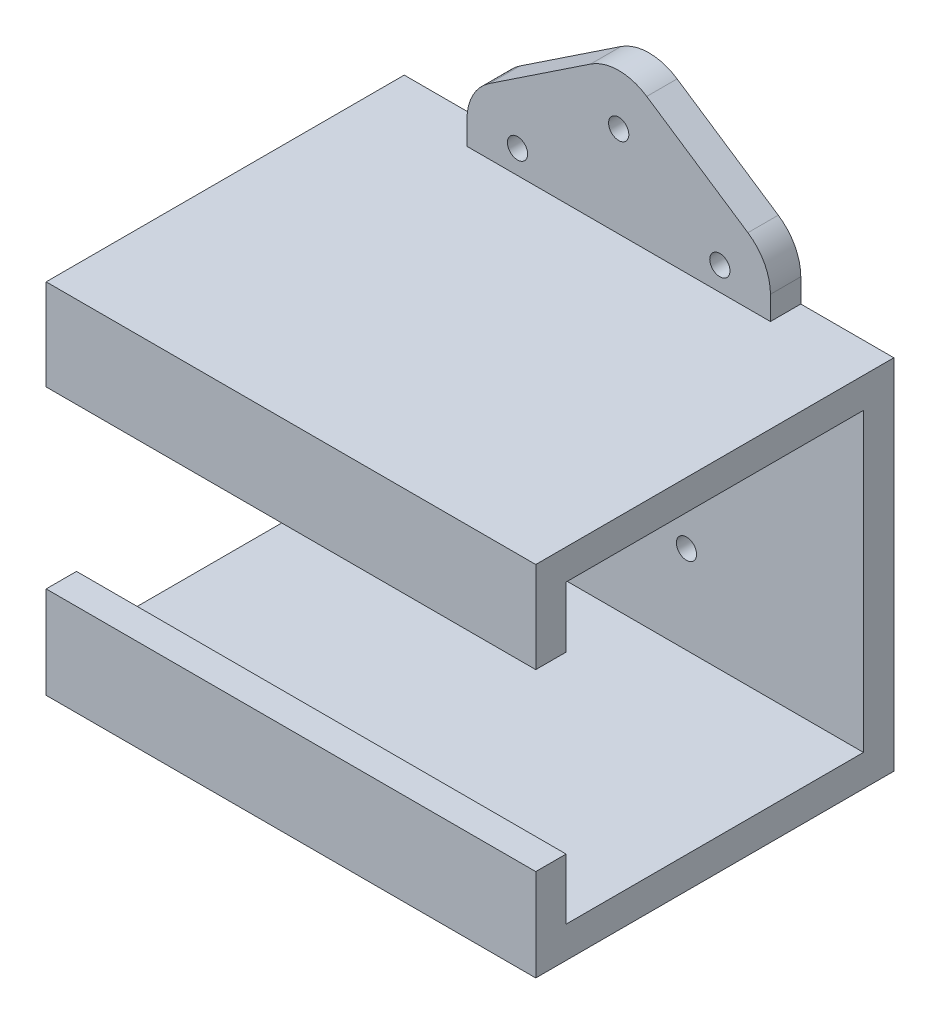
from build123d import *

# Parameters (mm, degrees)
SKETCH4_W                = 48.4
SKETCH4_H                = 35.4
BOTTOM_PLATE_DEPTH       = 3
SKETCH5_W                = 48.4
SKETCH5_H                = 3
SKETCH5_H_2              = 3.111627182
SIDE_PLATE_DEPTH         = 32.4
SKETCH6_W                = 48.4
SKETCH6_H                = 3
TOP_PLATE_1_DEPTH        = 6
SKETCH7_W                = 48.4
SKETCH7_H                = 3
TOP_PLATE_2_DEPTH        = 6
CAMERA_SCREW_HOLES_REACH = 64.688
SKETCH8_R                = 1
SKETCH10_R               = 1
CASE_ATTACHMENT_1_DEPTH  = 3
SKETCH10_4_R             = 1
CASE_ATTACHMENT_2_DEPTH  = 3


with BuildPart() as part:
    # Sketch4 → Bottom_Plate (new body)
    with BuildSketch(Plane.XY):
        with Locations((-19.226323529, -13.831389527)):
            Rectangle(SKETCH4_W, SKETCH4_H)
    extrude(amount=BOTTOM_PLATE_DEPTH)

    # Sketch5 → Side_Plate (add)
    with BuildSketch(Plane.XY.offset(3)):
        with Locations((-19.226323529, 2.368610473)):
            Rectangle(SKETCH5_W, SKETCH5_H)
        with Locations((-19.226323529, -29.975575936)):
            Rectangle(SKETCH5_W, SKETCH5_H_2)
    extrude(amount=SIDE_PLATE_DEPTH)

    # Sketch6 → Top_Plate_1 (add)
    with BuildSketch(Plane.XZ.offset(-0.868610473)):
        with Locations((-19.226323529, 33.9)):
            Rectangle(SKETCH6_W, SKETCH6_H)
    extrude(amount=TOP_PLATE_1_DEPTH)

    # Sketch7 → Top_Plate_2 (add)
    with BuildSketch(Plane(origin=(0, -28.419762345, 0), x_dir=(1, 0, 0), z_dir=(0, 1, 0))):
        with Locations((-19.226323529, -33.9)):
            Rectangle(SKETCH7_W, SKETCH7_H)
    extrude(amount=TOP_PLATE_2_DEPTH)

    # Sketch8 → Camera_Screw_Holes (cut, up to next)
    with BuildSketch(Plane.XY.offset(3), mode=Mode.PRIVATE) as camera_screw_holes_sk1:
        with Locations((-34.526323529, -19.719762345)):
            Circle(SKETCH8_R)
    camera_screw_holes_tool1 = extrude(camera_screw_holes_sk1.sketch, amount=-CAMERA_SCREW_HOLES_REACH, mode=Mode.PRIVATE) & part.part
    # Sketch8 → Camera_Screw_Holes (cut, up to next)
    with BuildSketch(Plane.XY.offset(3), mode=Mode.PRIVATE) as camera_screw_holes_sk2:
        with Locations((-34.611878154, -7.831372789)):
            Circle(SKETCH8_R)
    camera_screw_holes_tool2 = extrude(camera_screw_holes_sk2.sketch, amount=-CAMERA_SCREW_HOLES_REACH, mode=Mode.PRIVATE) & part.part
    # Sketch8 → Camera_Screw_Holes (cut, up to next)
    with BuildSketch(Plane.XY.offset(3), mode=Mode.PRIVATE) as camera_screw_holes_sk3:
        with Locations((-12.611878575, -7.835676936)):
            Circle(SKETCH8_R)
    camera_screw_holes_tool3 = extrude(camera_screw_holes_sk3.sketch, amount=-CAMERA_SCREW_HOLES_REACH, mode=Mode.PRIVATE) & part.part
    # Sketch8 → Camera_Screw_Holes (cut, up to next)
    with BuildSketch(Plane.XY.offset(3), mode=Mode.PRIVATE) as camera_screw_holes_sk4:
        with Locations((-12.526323529, -19.719762345)):
            Circle(SKETCH8_R)
    camera_screw_holes_tool4 = extrude(camera_screw_holes_sk4.sketch, amount=-CAMERA_SCREW_HOLES_REACH, mode=Mode.PRIVATE) & part.part
    add(camera_screw_holes_tool1.solids().sort_by_distance((-34.526324, -19.719762, 3))[0], mode=Mode.SUBTRACT)
    add(camera_screw_holes_tool2.solids().sort_by_distance((-34.611878, -7.831373, 3))[0], mode=Mode.SUBTRACT)
    add(camera_screw_holes_tool3.solids().sort_by_distance((-12.611879, -7.835677, 3))[0], mode=Mode.SUBTRACT)
    add(camera_screw_holes_tool4.solids().sort_by_distance((-12.526324, -19.719762, 3))[0], mode=Mode.SUBTRACT)

    # Sketch10 → Case_Attachment_1 (add)
    with BuildSketch(Plane(origin=(0, 0, 0), x_dir=(-1, 0, 0), z_dir=(0, 0, -1))):
        with BuildLine():
            Line((4.226323529, 6.201943806), (4.226323529, 3.868610473))
            Line((4.226323529, 3.868610473), (34.226323529, 3.868610473))
            Line((34.226323529, 3.868610473), (34.226323529, 6.201943806))
            ThreePointArc((34.226323529, 6.201943806), (33.634696523, 8.561233434), (31.99982451, 10.362195278))
            Line((31.99982451, 10.362195278), (21.99982451, 17.028861945))
            ThreePointArc((21.99982451, 17.028861945), (19.226323529, 17.868610473), (16.452822548, 17.028861945))
            Line((16.452822548, 17.028861945), (6.452822548, 10.362195278))
            ThreePointArc((6.452822548, 10.362195278), (4.817950535, 8.561233434), (4.226323529, 6.201943806))
        make_face()
        with Locations((9.226323529, 6.201943806)):
            Circle(SKETCH10_R, mode=Mode.SUBTRACT)
        with Locations((19.226323529, 12.868610473)):
            Circle(SKETCH10_R, mode=Mode.SUBTRACT)
        with Locations((29.226323529, 6.201943806)):
            Circle(SKETCH10_R, mode=Mode.SUBTRACT)
    extrude(amount=-CASE_ATTACHMENT_1_DEPTH)

    # Sketch10<4> → Case_Attachment_2 (add)
    with BuildSketch(Plane(origin=(0, 0, 0), x_dir=(-1, 0, 0), z_dir=(0, 0, -1))):
        with BuildLine():
            ThreePointArc((4.226323529, -33.86472286), (4.817950535, -36.224012488), (6.452822548, -38.024974332))
            Line((6.452822548, -38.024974332), (16.452822548, -44.691640999))
            ThreePointArc((16.452822548, -44.691640999), (19.226323529, -45.531389527), (21.99982451, -44.691640999))
            Line((21.99982451, -44.691640999), (31.99982451, -38.024974332))
            ThreePointArc((31.99982451, -38.024974332), (33.634696523, -36.224012488), (34.226323529, -33.86472286))
            Line((34.226323529, -33.86472286), (34.226323529, -31.531389527))
            Line((34.226323529, -31.531389527), (4.226323529, -31.531389527))
            Line((4.226323529, -31.531389527), (4.226323529, -33.86472286))
        make_face()
        with Locations((9.226323529, -33.86472286)):
            Circle(SKETCH10_4_R, mode=Mode.SUBTRACT)
        with Locations((19.226323529, -40.531389527)):
            Circle(SKETCH10_4_R, mode=Mode.SUBTRACT)
        with Locations((29.226323529, -33.86472286)):
            Circle(SKETCH10_4_R, mode=Mode.SUBTRACT)
    extrude(amount=-CASE_ATTACHMENT_2_DEPTH)


solid = part.part
